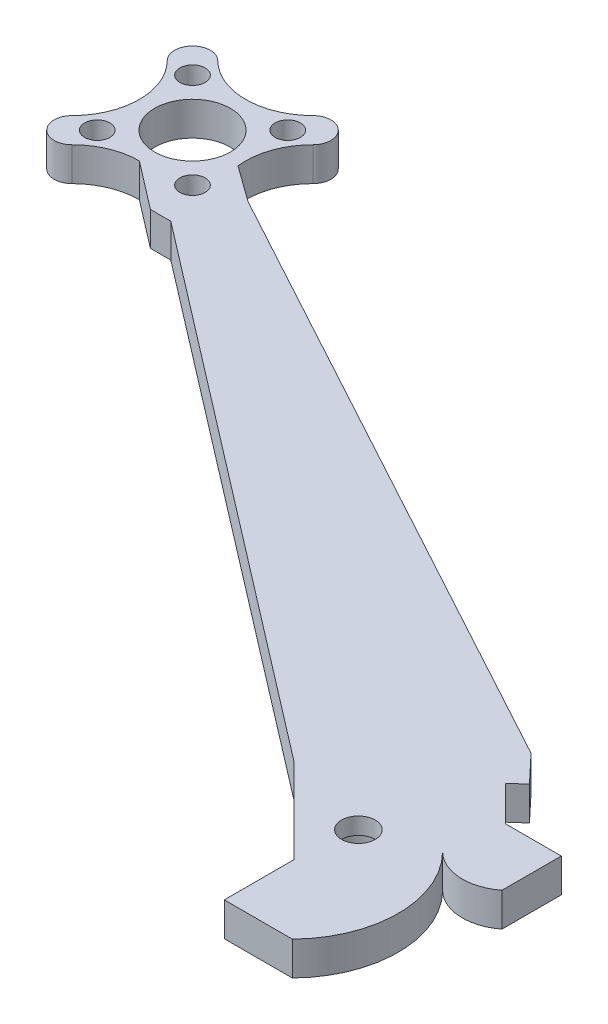
from build123d import *

# Parameters (mm, degrees)
SKETCH1_W            = 16.31
SKETCH1_H            = 16.31
SKETCH1_R            = 4.5
BOSS_EXTRUDE1_DEPTH  = 4
SKETCH3_R            = 1.5
CUT_EXTRUDE1_DEPTH   = 4
BOSS_EXTRUDE2_DEPTH  = 4
BOSS_EXTRUDE6_DEPTH  = 4
CUT_EXTRUDE3_DEPTH   = 4
BOSS_EXTRUDE7_DEPTH  = 4
BOSS_EXTRUDE9_DEPTH  = 4
SKETCH17_OUTSIDE_W   = 136.165
SKETCH17_OUTSIDE_H   = 117.232
CUT_EXTRUDE4_DEPTH   = 4
SKETCH18_R           = 1.5
BOSS_EXTRUDE10_DEPTH = 4
CUT_EXTRUDE5_DEPTH   = 4
SKETCH20_R           = 2
CUT_EXTRUDE6_DEPTH   = 10
SKETCH21_R           = 3
CUT_EXTRUDE7_DEPTH   = 2


with BuildPart() as part:
    # Sketch1 → Boss-Extrude1 (new body)
    with BuildSketch(Plane(origin=(0, 0, 0), x_dir=(1, 0, 0), z_dir=(0, 1, 0))):
        Rectangle(SKETCH1_W, SKETCH1_H)
        with Locations(Location((0, 0, 0), (0, 0, 270))):
            Circle(SKETCH1_R, mode=Mode.SUBTRACT)
    extrude(amount=BOSS_EXTRUDE1_DEPTH)

    # Sketch3 → Cut-Extrude1 (cut)
    with BuildSketch(Plane(origin=(0, 4, 0), x_dir=(1, 0, 0), z_dir=(0, 1, 0))):
        with Locations(Location((5.656854249, 5.656854249, 0), (0, 0, 270))):
            Circle(SKETCH3_R)
        with Locations(Location((5.656854249, -5.656854249, 0), (0, 0, 270))):
            Circle(SKETCH3_R)
        with Locations(Location((-5.656854249, -5.656854249, 0), (0, 0, 270))):
            Circle(SKETCH3_R)
        with Locations(Location((-5.656854249, 5.656854249, 0), (0, 0, 270))):
            Circle(SKETCH3_R)
    extrude(amount=-CUT_EXTRUDE1_DEPTH, mode=Mode.SUBTRACT)

    # Sketch4 → Boss-Extrude2 (add)
    with BuildSketch(Plane(origin=(0, 4, 0), x_dir=(1, 0, 0), z_dir=(0, 1, 0))):
        Polygon((8.155, -8.155), (0, -8.155), (0, -10.655), (10.655, -10.655), (10.655, 0), (8.155, 0), align=None)
    extrude(amount=-BOSS_EXTRUDE2_DEPTH)

    # Sketch9 → Boss-Extrude6 (add)
    with BuildSketch(Plane(origin=(0, 4, 0), x_dir=(1, 0, 0), z_dir=(0, 1, 0))):
        Polygon((71.061407011, -58.982568069), (7.593139788, -10.281653748), (10.613791504, -4.032054751), (84.193483815, -43.982568069), (90.501950314, -50.291034568), (96.061407011, -50.291034568), (96.061407011, -73.982568069), (81.061407011, -73.982568069), (81.061407011, -68.982568069), align=None)
    extrude(amount=-BOSS_EXTRUDE6_DEPTH)

    # Sketch12 → Cut-Extrude3 (cut)
    with BuildSketch(Plane(origin=(0, 4, 0), x_dir=(1, 0, 0), z_dir=(0, 1, 0))):
        Polygon((87.278639473, -47.258318902), (85.780514725, -48.583317861), (89.960889469, -52.761034568), (90.501950314, -52.761034568), (96.061407011, -52.761034568), (96.061407011, -50.291034568), (90.501950314, -50.291034568), (87.347717064, -47.136801318), align=None)
    extrude(amount=-CUT_EXTRUDE3_DEPTH, mode=Mode.SUBTRACT)

    # Sketch13 → Boss-Extrude7 (add)
    with BuildSketch(Plane(origin=(0, 4, 0), x_dir=(1, 0, 0), z_dir=(0, 1, 0))):
        Polygon((81.061407011, -73.982568069), (81.061407011, -77.282568069), (96.561407011, -77.282568069), (96.561407011, -52.761034568), (96.061407011, -52.761034568), (96.061407011, -73.982568069), align=None)
    extrude(amount=-BOSS_EXTRUDE7_DEPTH)

    # Sketch16 → Boss-Extrude9 (add)
    with BuildSketch(Plane(origin=(0, 4, 0), x_dir=(1, 0, 0), z_dir=(0, 1, 0))):
        Polygon((0, -10.655), (-10, -10.655), (-10, 10.345), (10.655, 10.345), (10.655, 0), (8.155, 0), (8.155, 8.155), (-8.155, 8.155), (-8.155, -8.155), (0, -8.155), align=None)
    extrude(amount=-BOSS_EXTRUDE9_DEPTH)

    # Sketch17 outside → Cut-Extrude4 (cut)
    with BuildSketch(Plane(origin=(0, 4, 0), x_dir=(1, 0, 0), z_dir=(0, 1, 0))):
        with Locations((43.2805, -33.469)):
            Rectangle(SKETCH17_OUTSIDE_W, SKETCH17_OUTSIDE_H)
        with BuildLine():
            Line((5.656854249, -8.656854249), (5.656854249, -10.655))
            Line((5.656854249, -10.655), (8.079694096, -10.655))
            Line((8.079694096, -10.655), (71.061407011, -58.982568069))
            Line((71.061407011, -58.982568069), (81.061407011, -68.982568069))
            Line((81.061407011, -68.982568069), (81.061407011, -77.282568069))
            Line((81.061407011, -77.282568069), (96.561407011, -77.282568069))
            Line((96.561407011, -77.282568069), (96.561407011, -52.761034568))
            Line((96.561407011, -52.761034568), (89.960889469, -52.761034568))
            Line((89.960889469, -52.761034568), (85.780514725, -48.583317861))
            Line((85.780514725, -48.583317861), (87.278639473, -47.258318902))
            Line((87.278639473, -47.258318902), (84.193483815, -43.982568069))
            Line((84.193483815, -43.982568069), (10.655, -4.054429139))
            Line((10.655, -4.054429139), (8.656854249, -5.656854249))
            ThreePointArc((8.656854249, -5.656854249), (6.313708499, 0), (8.656854249, 5.656854249))
            ThreePointArc((8.656854249, 5.656854249), (8.656854249, 8.656854249), (5.656854249, 8.656854249))
            ThreePointArc((5.656854249, 8.656854249), (0, 6.313708499), (-5.656854249, 8.656854249))
            ThreePointArc((-5.656854249, 8.656854249), (-8.656854249, 8.656854249), (-8.656854249, 5.656854249))
            ThreePointArc((-8.656854249, 5.656854249), (-6.313708499, 0), (-8.656854249, -5.656854249))
            ThreePointArc((-8.656854249, -5.656854249), (-8.656854249, -8.656854249), (-5.656854249, -8.656854249))
            ThreePointArc((-5.656854249, -8.656854249), (0, -6.313708499), (5.656854249, -8.656854249))
        make_face(mode=Mode.SUBTRACT)
    extrude(amount=-CUT_EXTRUDE4_DEPTH, mode=Mode.SUBTRACT)

    # Sketch18 → Boss-Extrude10 (add)
    with BuildSketch(Plane(origin=(0, 4, 0), x_dir=(1, 0, 0), z_dir=(0, 1, 0))):
        Polygon((5.656854249, -10.655), (0, -6.313708499), (6.372805828, -0.97060021), (10.655, -4.054429139), (8.656854249, -5.656854249), align=None)
        with Locations(Location((5.656854249, -5.656854249, 0), (0, 0, 270))):
            Circle(SKETCH18_R, mode=Mode.SUBTRACT)
    extrude(amount=-BOSS_EXTRUDE10_DEPTH)

    # Sketch19 → Cut-Extrude5 (cut)
    with BuildSketch(Plane(origin=(0, 4, 0), x_dir=(1, 0, 0), z_dir=(0, 1, 0))):
        with BuildLine():
            Line((97.061407011, -77.355955856), (97.061407011, -59.355955856))
            ThreePointArc((97.061407011, -59.355955856), (93.061407011, -61.012810105), (89.061407011, -59.355955856))
            ThreePointArc((89.061407011, -59.355955856), (92.789329073, -68.355955856), (89.061407011, -77.355955856))
            Line((89.061407011, -77.355955856), (97.061407011, -77.355955856))
        make_face()
    extrude(amount=-CUT_EXTRUDE5_DEPTH, mode=Mode.SUBTRACT)

    # Sketch20 → Cut-Extrude6 (cut)
    with BuildSketch(Plane.XZ):
        with Locations(Location((81.807805677, 62.103797793, 0), (0, 0, 270))):
            Circle(SKETCH20_R)
    extrude(amount=-CUT_EXTRUDE6_DEPTH, mode=Mode.SUBTRACT)

    # Sketch21 → Cut-Extrude7 (cut)
    with BuildSketch(Plane.XZ):
        with Locations(Location((81.807805677, 62.103797793, 0), (0, 0, 270))):
            Circle(SKETCH21_R)
    extrude(amount=-CUT_EXTRUDE7_DEPTH, mode=Mode.SUBTRACT)


solid = part.part
